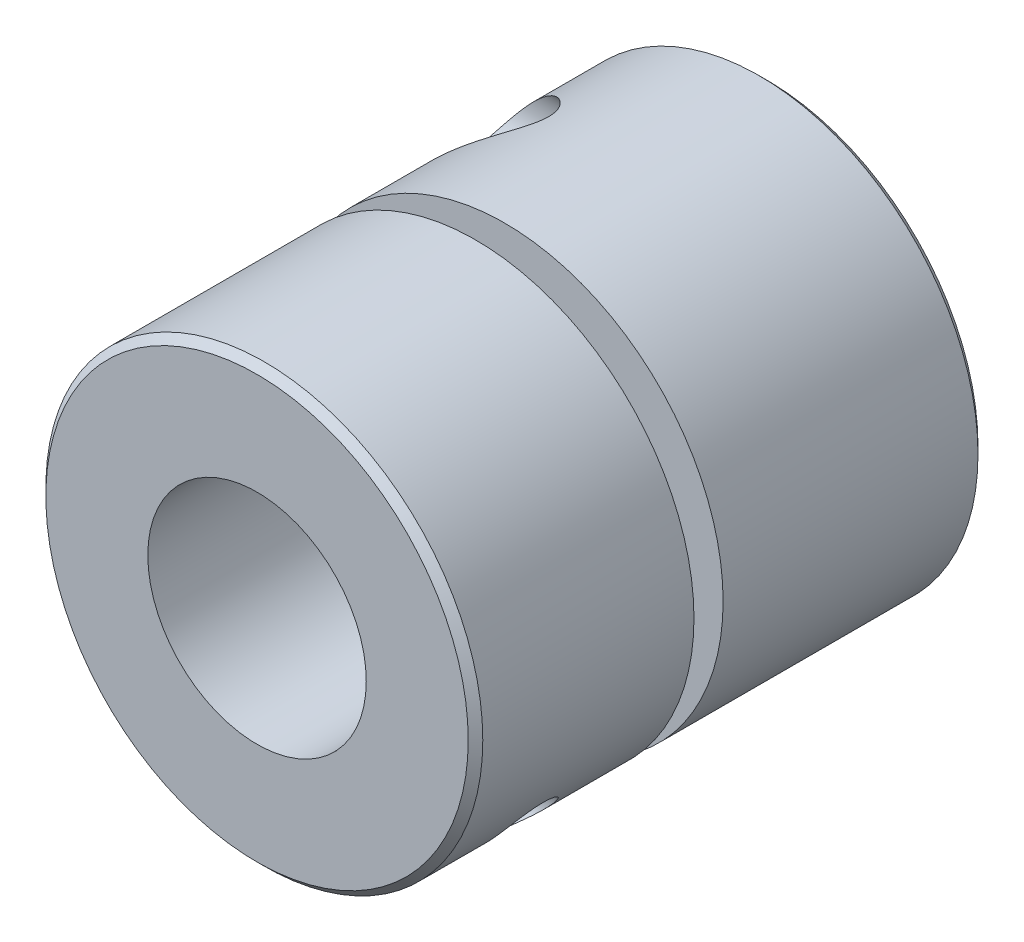
from build123d import *

# Parameters (mm, degrees)
SKETCH_1_R          = 15
SKETCH_1_R_2        = 4
EXTRUDE_1_DEPTH     = 35
SKETCH_2_R          = 7.5
CUT_EXTRUDE_1_DEPTH = 15
SKETCH_3_R          = 2
CUT_EXTRUDE_2_DEPTH = 6
SKETCH_4_R          = 3.5
CUT_EXTRUDE_3_DEPTH = 10
CUT_EXTRUDE_START   = -2
SKETCH_5_R          = 15
SKETCH_5_R_2        = 12
CUT_EXTRUDE_4_DEPTH = 2
SKETCH_6_R          = 2
CUT_EXTRUDE_5_DEPTH = 20
CHAMFER_1_SIZE      = 0.5


with BuildPart() as part:
    # 草图1 → 凸台-拉伸1 (new body)
    with BuildSketch(Plane.XY):
        Circle(SKETCH_1_R)
        Circle(SKETCH_1_R_2, mode=Mode.SUBTRACT)
    extrude(amount=EXTRUDE_1_DEPTH)

    # 草图2 → 切除-拉伸1 (cut)
    with BuildSketch(Plane.XY.offset(35)):
        Circle(SKETCH_2_R)
    extrude(amount=-CUT_EXTRUDE_1_DEPTH, mode=Mode.SUBTRACT)

    # 草图3 → 切除-拉伸2 (cut, symmetric)
    with BuildSketch(Plane(origin=(0, 0, 0), x_dir=(0, 0, -1), z_dir=(1, 0, 0))):
        with Locations((-8.856511141, 10.195845598)):
            Circle(SKETCH_3_R)
    extrude(amount=CUT_EXTRUDE_2_DEPTH, both=True, mode=Mode.SUBTRACT)

    # 草图4 → 切除-拉伸3 (cut)
    with BuildSketch(Plane.ZY.offset(14)):
        with Locations((8.856511141, 10.195845598)):
            Circle(SKETCH_4_R)
    extrude(amount=-CUT_EXTRUDE_3_DEPTH, mode=Mode.SUBTRACT)

    # 草图5 → 切除-拉伸4 (cut)
    with BuildSketch(Plane.XY.offset(20).offset(CUT_EXTRUDE_START)):
        Circle(SKETCH_5_R)
        Circle(SKETCH_5_R_2, mode=Mode.SUBTRACT)
    extrude(amount=CUT_EXTRUDE_4_DEPTH, mode=Mode.SUBTRACT)

    # 草图6 → 切除-拉伸5 (cut, symmetric)
    with BuildSketch(Plane(origin=(0, 0, 0), x_dir=(0, 0, -1), z_dir=(1, 0, 0))):
        with Locations((-27.877925761, -10.249978731)):
            Circle(SKETCH_6_R)
    extrude(amount=CUT_EXTRUDE_5_DEPTH, both=True, mode=Mode.SUBTRACT)

    # 倒角1
    chamfer_1_edges = [part.edges().sort_by_distance(p)[0] for p in [
        (-15, 0, 0),
        (-15, 0, 35),
    ]]
    chamfer(chamfer_1_edges, length=CHAMFER_1_SIZE)


solid = part.part
